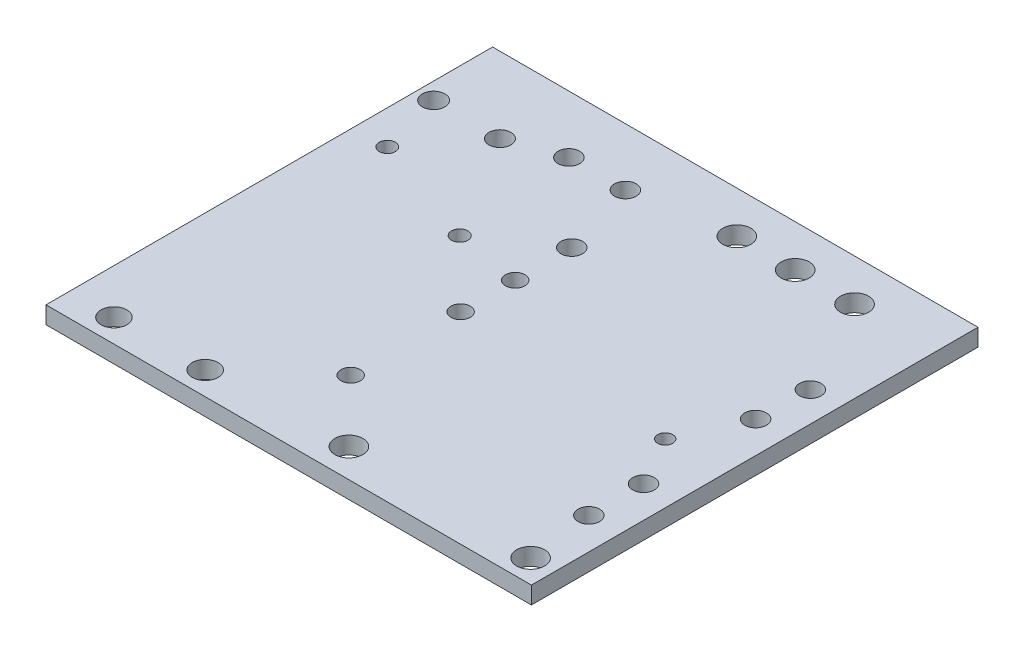
from build123d import *

# Parameters (mm, degrees)
ESBO_O1_W                = 22.5
ESBO_O1_H                = 20.7
RESSALTO_EXTRUS_O1_DEPTH = 0.8
ESBO_O2_R                = 0.5
ESBO_O2_R_2              = 0.65
ESBO_O2_R_3              = 0.45
ESBO_O2_R_4              = 0.507049464
ESBO_O2_R_5              = 0.6
ESBO_O2_R_6              = 0.375708805
ESBO_O2_R_7              = 0.378805018
ESBO_O2_R_8              = 0.350015613
ESBO_O2_R_9              = 0.522974081
CORTE_EXTRUS_O1_DEPTH    = 2


with BuildPart() as part:
    # Esboço1 → Ressalto-extrusão1 (new body)
    with BuildSketch(Plane(origin=(0, 0, 0), x_dir=(1, 0, 0), z_dir=(0, 1, 0))):
        Rectangle(ESBO_O1_W, ESBO_O1_H)
    extrude(amount=RESSALTO_EXTRUS_O1_DEPTH)

    # Esboço2 → Corte-extrusão1 (cut)
    with BuildSketch(Plane(origin=(0, 0.8, 0), x_dir=(1, 0, 0), z_dir=(0, 1, 0))):
        with Locations(Location((-1.362497423, 4.13217589, 0), (0, 0, 270))):
            Circle(ESBO_O2_R)
        with Locations(Location((9.781964431, 1.510174659, 0), (0, 0, 270))):
            Circle(ESBO_O2_R)
        with Locations(Location((9.781964431, -3.684410863, 0), (0, 0, 270))):
            Circle(ESBO_O2_R)
        with Locations(Location((9.781964431, -6.220381714, 0), (0, 0, 270))):
            Circle(ESBO_O2_R)
        with Locations(Location((10.140573187, -9.276881362, 0), (0, 0, 270))):
            Circle(ESBO_O2_R_2)
        with Locations(Location((1.456478245, -9.018440966, 0), (0, 0, 270))):
            Circle(ESBO_O2_R_2)
        with Locations(Location((-5.049050046, 7.684323928, 0), (0, 0, 270))):
            Circle(ESBO_O2_R)
        with Locations(Location((-2.429917945, 7.684323928, 0), (0, 0, 270))):
            Circle(ESBO_O2_R)
        with Locations(Location((-1.362497423, -6.113976729, 0), (0, 0, 270))):
            Circle(ESBO_O2_R_3)
        with Locations(Location((9.868300548, 3.960954596, 0), (0, 0, 270))):
            Circle(ESBO_O2_R)
        with Locations(Location((-1.362497423, 1.510174659, 0), (0, 0, 270))):
            Circle(ESBO_O2_R_3)
        with Locations(Location((-1.362497423, -1.018750271, 0), (0, 0, 270))):
            Circle(ESBO_O2_R_3)
        with Locations(Location((2.009813707, 8.41282711, 0), (0, 0, 270))):
            Circle(ESBO_O2_R_2)
        with Locations(Location((4.713446832, 8.41282711, 0), (0, 0, 270))):
            Circle(ESBO_O2_R_2)
        with Locations(Location((7.464512117, 8.41282711, 0), (0, 0, 270))):
            Circle(ESBO_O2_R_2)
        with Locations(Location((-7.40057526, 6.840223885, 0), (0, 0, 270))):
            Circle(ESBO_O2_R_4)
        with Locations(Location((-9.173194548, -9.276881362, 0), (0, 0, 270))):
            Circle(ESBO_O2_R_5)
        with Locations(Location((-4.945655629, -9.276881362, 0), (0, 0, 270))):
            Circle(ESBO_O2_R_5)
        with Locations(Location((-9.677939464, 3.896952444, 0), (0, 0, 270))):
            Circle(ESBO_O2_R_6)
        with Locations(Location((-4.441443384, 2.017609351, 0), (0, 0, 270))):
            Circle(ESBO_O2_R_7)
        with Locations(Location((8.485674085, -1.384098552, 0), (0, 0, 270))):
            Circle(ESBO_O2_R_8)
        with Locations(Location((-10.473206437, 6.840223885, 0), (0, 0, 270))):
            Circle(ESBO_O2_R_9)
    extrude(amount=-CORTE_EXTRUS_O1_DEPTH, mode=Mode.SUBTRACT)


solid = part.part
